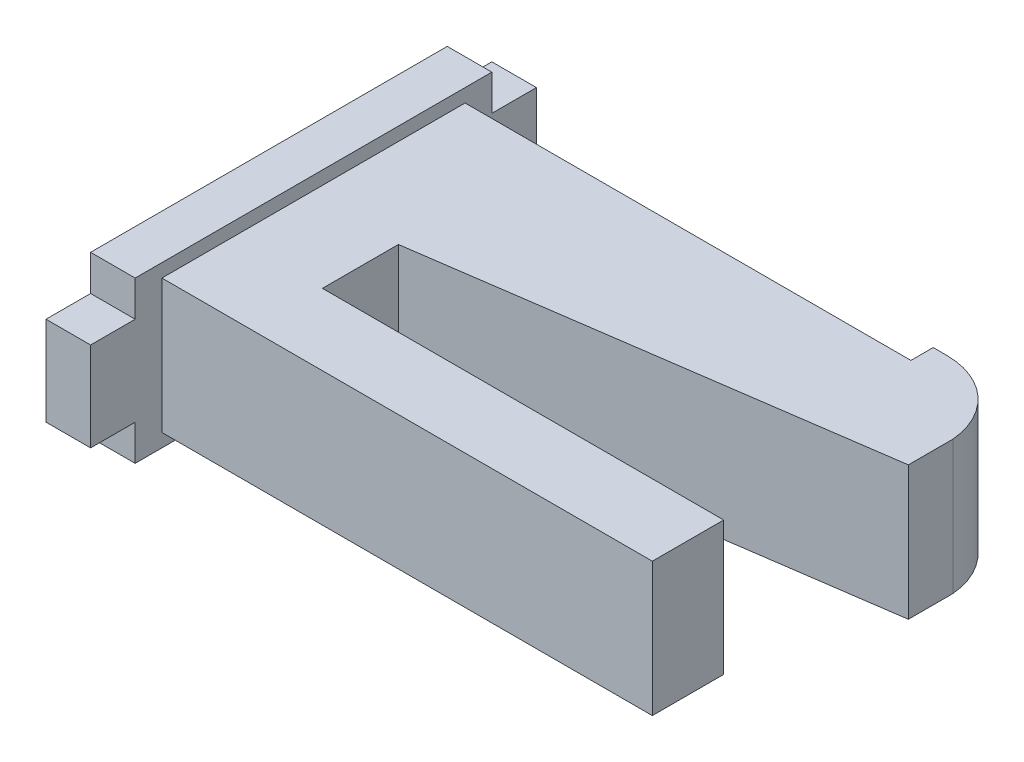
from build123d import *

# Parameters (mm, degrees)
BOSS_EXTRUDE1_DEPTH = 15
SKETCH4_W           = 5
SKETCH4_H           = 40
BOSS_EXTRUDE2_DEPTH = 1.5
SKETCH5_W           = 5
SKETCH5_H           = 40
BOSS_EXTRUDE3_DEPTH = 1.5
SKETCH6_W           = 8
SKETCH6_H           = 15
BOSS_EXTRUDE4_DEPTH = 45
SKETCH7_W           = 5
SKETCH7_H           = 10
BOSS_EXTRUDE5_DEPTH = 5
SKETCH8_W           = 5
SKETCH8_H           = 10
BOSS_EXTRUDE6_DEPTH = 5


with BuildPart() as part:
    # Sketch2 → Boss-Extrude1 (new body)
    with BuildSketch(Plane(origin=(0, 0, 0), x_dir=(1, 0, 0), z_dir=(0, 1, 0))):
        with BuildLine():
            Line((0, 0), (0, 40))
            Line((0, 40), (5, 40))
            Line((5, 40), (5, 37))
            Line((5, 37), (55, 37))
            Line((55, 37), (55, 39.5))
            Line((55, 39.5), (56.5, 39.5))
            ThreePointArc((56.5, 39.5), (62.264260255, 37.258522387), (65, 31.711753397))
            Line((65, 31.711753397), (65, 26.711753397))
            Line((65, 26.711753397), (15, 19.51828483))
            Line((15, 19.51828483), (15, 3))
            Line((15, 3), (5, 3))
            Line((5, 3), (5, 0))
            Line((5, 0), (0, 0))
        make_face()
    extrude(amount=BOSS_EXTRUDE1_DEPTH)

    # Sketch4 → Boss-Extrude2 (add)
    with BuildSketch(Plane(origin=(0, 15, 0), x_dir=(1, 0, 0), z_dir=(0, 1, 0))):
        with Locations((2.5, 20)):
            Rectangle(SKETCH4_W, SKETCH4_H)
    extrude(amount=BOSS_EXTRUDE2_DEPTH)

    # Sketch5 → Boss-Extrude3 (add)
    with BuildSketch(Plane.XZ):
        with Locations((2.5, -20)):
            Rectangle(SKETCH5_W, SKETCH5_H)
    extrude(amount=BOSS_EXTRUDE3_DEPTH)

    # Sketch6 → Boss-Extrude4 (add)
    with BuildSketch(Plane(origin=(15, 0, 0), x_dir=(0, 0, -1), z_dir=(1, 0, 0))):
        with Locations((7, 7.5)):
            Rectangle(SKETCH6_W, SKETCH6_H)
    extrude(amount=BOSS_EXTRUDE4_DEPTH)

    # Sketch7 → Boss-Extrude5 (add)
    with BuildSketch(Plane.XY):
        with Locations((2.5, 7.5)):
            Rectangle(SKETCH7_W, SKETCH7_H)
    extrude(amount=BOSS_EXTRUDE5_DEPTH)

    # Sketch8 → Boss-Extrude6 (add)
    with BuildSketch(Plane(origin=(0, 0, -40), x_dir=(-1, 0, 0), z_dir=(0, 0, -1))):
        with Locations((-2.5, 7.5)):
            Rectangle(SKETCH8_W, SKETCH8_H)
    extrude(amount=BOSS_EXTRUDE6_DEPTH)


solid = part.part
